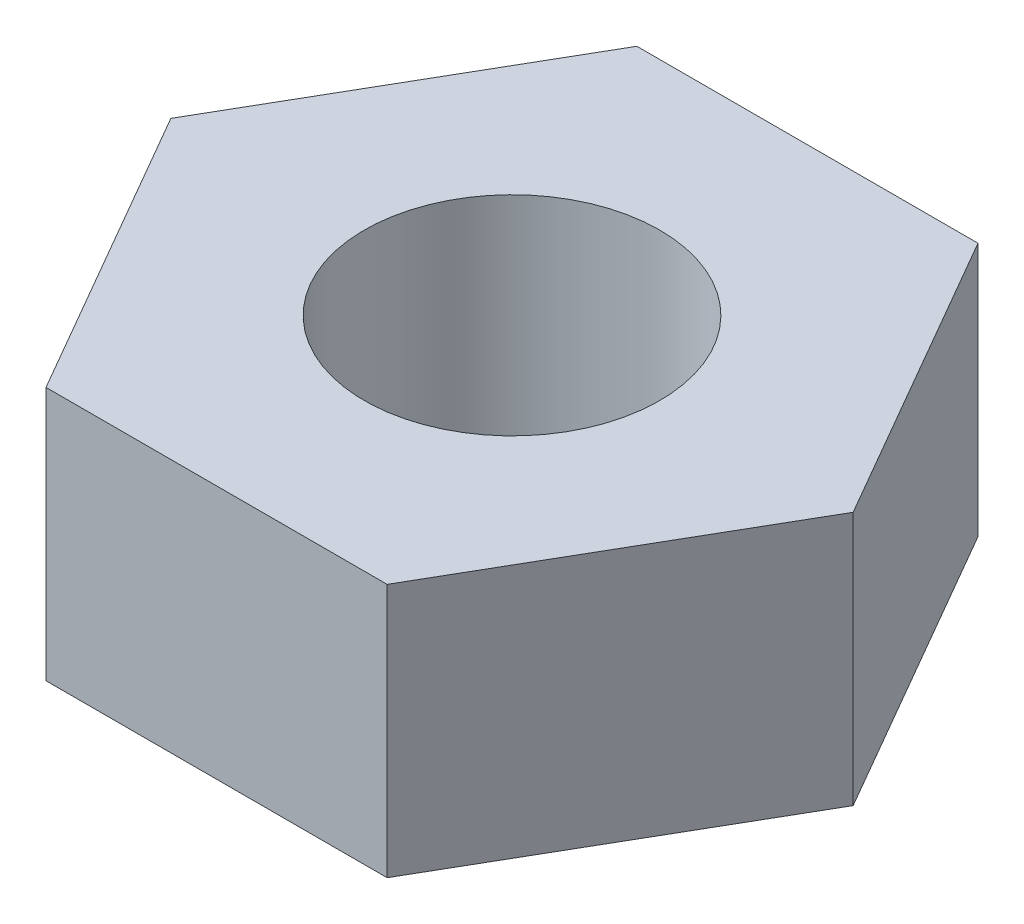
from build123d import *

# Parameters (mm, degrees)
ESQUISSE1_R        = 1.25
BOSS_EXTRU_1_DEPTH = 2.15


with BuildPart() as part:
    # Esquisse1 → Boss.-Extru.1 (new body)
    with BuildSketch(Plane(origin=(0, 0, 0), x_dir=(1, 0, 0), z_dir=(0, 1, 0))):
        Polygon((1.443375673, 2.5), (-1.443375673, 2.5), (-2.886751346, 0), (-1.443375673, -2.5), (1.443375673, -2.5), (2.886751346, 0), align=None)
        with Locations(Location((0, 0, 0), (0, 0, 90))):
            Circle(ESQUISSE1_R, mode=Mode.SUBTRACT)
    extrude(amount=BOSS_EXTRU_1_DEPTH)


solid = part.part
